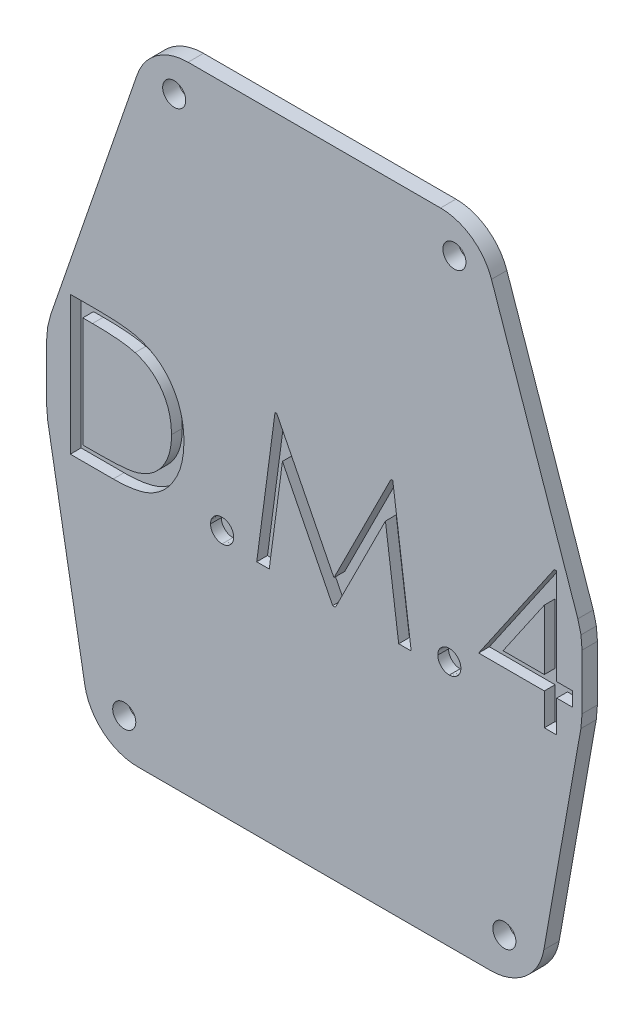
from build123d import *

# Parameters (mm, degrees)
SKETCH1_R           = 1.5
BOSS_EXTRUDE1_DEPTH = 2
CUT_EXTRUDE1_DEPTH  = 1.4


with BuildPart() as part:
    # Sketch1 → Boss-Extrude1 (new body)
    with BuildSketch(Plane.XY):
        with BuildLine():
            Line((-18.379825178, 53.839866214), (-29.600588692, 21.252402761))
            Line((-29.600588692, 21.252402761), (-30.008258951, 19.647197275))
            Line((-30.008258951, 19.647197275), (-30.145402936, 17.996721216))
            Line((-30.145402936, 17.996721216), (-30.145402936, 10.828474845))
            Line((-30.145402936, 10.828474845), (-29.993480466, 9.091993069))
            Line((-29.993480466, 9.091993069), (-25.178426095, -18.215537244))
            ThreePointArc((-25.178426095, -18.215537244), (-22.784285092, -22.362311102), (-18.284771824, -24))
            Line((-18.284771824, -24), (27.569413737, -24))
            ThreePointArc((27.569413737, -24), (32.068927004, -22.362311102), (34.463068008, -18.215537244))
            Line((34.463068008, -18.215537244), (39.278122378, 9.091993069))
            Line((39.278122378, 9.091993069), (39.430044848, 10.828474845))
            Line((39.430044848, 10.828474845), (39.430044848, 17.996721216))
            Line((39.430044848, 17.996721216), (39.292900864, 19.647197275))
            Line((39.292900864, 19.647197275), (38.885230604, 21.252402761))
            Line((38.885230604, 21.252402761), (27.66446709, 53.839866214))
            ThreePointArc((27.66446709, 53.839866214), (25.110757751, 57.259697761), (21.045837061, 58.560889132))
            Line((21.045837061, 58.560889132), (-11.761195149, 58.560889132))
            ThreePointArc((-11.761195149, 58.560889132), (-15.826115839, 57.259697761), (-18.379825178, 53.839866214))
        make_face()
        with Locations((-20.053399697, -19.107768622)):
            Circle(SKETCH1_R, mode=Mode.SUBTRACT)
        with Locations((29.33804161, -19.107768622)):
            Circle(SKETCH1_R, mode=Mode.SUBTRACT)
        with Locations((22.845645013, 54.084126822)):
            Circle(SKETCH1_R, mode=Mode.SUBTRACT)
        with Locations((-13.561003101, 54.084126822)):
            Circle(SKETCH1_R, mode=Mode.SUBTRACT)
    extrude(amount=BOSS_EXTRUDE1_DEPTH)

    # Sketch2 → Cut-Extrude1 (cut)
    # profile 1 of 5: a face of its own
    with BuildSketch(Plane.XY.offset(2)):
        with BuildLine():
            Line((-27.058965291, 6.803763441), (-27.058965291, 24.795430108))
            Line((-27.058965291, 24.795430108), (-23.426032599, 24.795430108))
            add(Edge.make_bspline(
                [(-23.426032599, 24.795430108), (-23.110052729, 24.793155088), (-22.499581264, 24.78875976), (-21.617411563, 24.760891228), (-20.801187413, 24.711591666), (-20.053593264, 24.63978165), (-19.372576748, 24.551606889), (-18.76004476, 24.441084572), (-18.212830054, 24.310577287), (-17.876285953, 24.199309365), (-17.717138368, 24.146692127)],
                knots=[0, 0, 0, 0, 1.314313732, 2.53924729, 3.670748893, 4.714932338, 5.66265055, 6.526160246, 7.303039223, 8, 8, 8, 8], degree=3))
            add(Edge.make_bspline(
                [(-17.717138368, 24.146692127), (-17.508976125, 24.067370952), (-17.097372067, 23.910527344), (-16.511321168, 23.614660547), (-15.959617695, 23.27943415), (-15.439303091, 22.904406275), (-14.962262653, 22.478958112), (-14.509860155, 22.021162284), (-14.100602563, 21.514371268), (-13.725819203, 20.969095318), (-13.387906611, 20.391757888), (-13.09418413, 19.783459079), (-12.850248007, 19.147288098), (-12.647748064, 18.485014087), (-12.488154488, 17.795180802), (-12.379269272, 17.076985), (-12.307451732, 16.333265072), (-12.300234239, 15.828601578), (-12.296572129, 15.572538482)],
                knots=[0, 0, 0, 0, 0.984719456, 1.947108742, 2.898477687, 3.838006223, 4.779231079, 5.722358779, 6.681677486, 7.655904652, 8.64651281, 9.637519902, 10.640069247, 11.656948941, 12.698408672, 13.768548281, 14.867775369, 16, 16, 16, 16], degree=3))
            add(Edge.make_bspline(
                [(-12.296572129, 15.572538482), (-12.299805321, 15.350155115), (-12.306176664, 14.911925464), (-12.363386648, 14.266071432), (-12.446540636, 13.639377621), (-12.575279738, 13.03482832), (-12.731563135, 12.447126838), (-12.931857427, 11.882536801), (-13.161305132, 11.335878981), (-13.428866294, 10.814544861), (-13.722600223, 10.320630573), (-14.037823184, 9.855029228), (-14.374198958, 9.424384695), (-14.734935128, 9.027392853), (-15.115370033, 8.664652178), (-15.517994389, 8.333132508), (-15.943847119, 8.039320599), (-16.391020858, 7.771670869), (-16.87256077, 7.538188613), (-17.397587758, 7.340640062), (-17.968340885, 7.176933294), (-18.583419202, 7.040346237), (-19.24388546, 6.931998865), (-19.950387192, 6.859382481), (-20.701838912, 6.810275858), (-21.217836135, 6.805976397), (-21.483422757, 6.803763441)],
                knots=[0, 0, 0, 0, 1.105936401, 2.179363191, 3.223086493, 4.248585256, 5.251745608, 6.245858792, 7.225916811, 8.198733463, 9.158002045, 10.082870192, 10.993790845, 11.873723703, 12.748670949, 13.606408763, 14.465103618, 15.319838547, 16.196477973, 17.123216899, 18.106603292, 19.147568657, 20.255746949, 21.433717677, 22.679120308, 24, 24, 24, 24], degree=3))
            Line((-21.483422757, 6.803763441), (-27.058965291, 6.803763441))
        make_face()
        with BuildLine():
            Line((-25.444328539, 8.649062587), (-23.3791793, 8.649062587))
            add(Edge.make_bspline(
                [(-23.3791793, 8.649062587), (-23.082427985, 8.65033792), (-22.511666528, 8.652790854), (-21.690948395, 8.674315072), (-20.94105883, 8.709485888), (-20.261891357, 8.758706348), (-19.653829444, 8.823829063), (-19.115602311, 8.896437789), (-18.648974257, 8.986897066), (-18.366610794, 9.068892593), (-18.236128753, 9.106783273)],
                knots=[0, 0, 0, 0, 1.375205317, 2.645023457, 3.804390687, 4.853969522, 5.800190428, 6.637939096, 7.370582563, 8, 8, 8, 8], degree=3))
            add(Edge.make_bspline(
                [(-18.236128753, 9.106783273), (-18.071898958, 9.16462164), (-17.747361994, 9.278916907), (-17.28018994, 9.487402598), (-16.844498575, 9.734361714), (-16.432694898, 10.008874832), (-16.050620495, 10.320624161), (-15.693747478, 10.662830744), (-15.362794361, 11.037236171), (-15.061180478, 11.443375745), (-14.791262791, 11.878721623), (-14.557519019, 12.338993866), (-14.35266317, 12.819149349), (-14.191876309, 13.326561429), (-14.065854532, 13.856693899), (-13.976591767, 14.409584052), (-13.920998934, 14.985128637), (-13.914514491, 15.376586818), (-13.911208881, 15.576142581)],
                knots=[0, 0, 0, 0, 0.998632004, 1.973411704, 2.929992603, 3.868527914, 4.809262121, 5.754881198, 6.702106254, 7.672490631, 8.653608572, 9.636854334, 10.631411391, 11.644891563, 12.686317036, 13.754757253, 14.855430412, 16, 16, 16, 16], degree=3))
            add(Edge.make_bspline(
                [(-13.911208881, 15.576142581), (-13.913847422, 15.786560162), (-13.919030861, 16.199927362), (-13.984182851, 16.806455722), (-14.079392467, 17.389800304), (-14.217073367, 17.950000123), (-14.392522337, 18.488148105), (-14.611479079, 19.00126792), (-14.861648676, 19.494778663), (-15.159299401, 19.957289748), (-15.485285749, 20.394708849), (-15.847061562, 20.795434237), (-16.238879136, 21.160378747), (-16.656464945, 21.495225833), (-17.111587796, 21.786504109), (-17.593526411, 22.047057787), (-18.109350945, 22.268179952), (-18.468221446, 22.385788201), (-18.65060024, 22.445556978)],
                knots=[0, 0, 0, 0, 1.122418816, 2.205001699, 3.251619955, 4.274784885, 5.280384055, 6.268708349, 7.249350384, 8.229342522, 9.199999885, 10.157847722, 11.105861043, 12.055065948, 13.010012805, 13.98527497, 14.976112212, 16, 16, 16, 16], degree=3))
            add(Edge.make_bspline(
                [(-18.65060024, 22.445556978), (-18.80147911, 22.487279282), (-19.122288982, 22.575992348), (-19.645792322, 22.672763727), (-20.234968769, 22.758118759), (-20.892434137, 22.830383776), (-21.617438978, 22.882237411), (-22.410540884, 22.921157573), (-23.27208266, 22.947408096), (-23.869316209, 22.949200617), (-24.179289477, 22.950130963)],
                knots=[0, 0, 0, 0, 0.674548936, 1.434276114, 2.292660221, 3.240891867, 4.284742987, 5.42552168, 6.663806718, 8, 8, 8, 8], degree=3))
            Line((-24.179289477, 22.950130963), (-25.444328539, 22.950130963))
            Line((-25.444328539, 22.950130963), (-25.444328539, 8.649062587))
        make_face(mode=Mode.SUBTRACT)
    # profile 2 of 5: a face of its own
    with BuildSketch(Plane.XY.offset(2)):
        with BuildLine():
            add(Edge.make_bspline(
                [(-7.337330676, 9.571712159), (-7.237141704, 9.565758631), (-7.040732938, 9.554087435), (-6.756777514, 9.474015914), (-6.499781156, 9.331837229), (-6.270864212, 9.142344994), (-6.082175444, 8.912588002), (-5.934929834, 8.657641414), (-5.855555817, 8.371308704), (-5.843969637, 8.173761875), (-5.83802512, 8.072406604)],
                knots=[0, 0, 0, 0, 1.020151414, 1.999887582, 2.974338812, 3.990962822, 5.007586832, 5.987933904, 6.967670073, 8, 8, 8, 8], degree=3))
            add(Edge.make_bspline(
                [(-5.83802512, 8.072406604), (-5.844171077, 7.973486725), (-5.856290815, 7.778418178), (-5.934747888, 7.494245135), (-6.083297628, 7.239139215), (-6.269562746, 7.006264652), (-6.499837746, 6.816370986), (-6.757385095, 6.675401936), (-7.040066348, 6.58959721), (-7.237030496, 6.578667031), (-7.337330676, 6.573101048)],
                knots=[0, 0, 0, 0, 1.009421747, 1.99056486, 2.972319754, 3.999869655, 5.017953583, 5.993804169, 6.978383603, 8, 8, 8, 8], degree=3))
            add(Edge.make_bspline(
                [(-7.337330676, 6.573101048), (-7.437703129, 6.578465635), (-7.63365645, 6.588938713), (-7.915282549, 6.67716371), (-8.174398371, 6.815049068), (-8.404628536, 7.006618729), (-8.59245368, 7.237940895), (-8.734461302, 7.496002034), (-8.819742568, 7.777604709), (-8.830958433, 7.973326504), (-8.836636231, 8.072406604)],
                knots=[0, 0, 0, 0, 1.022052826, 1.995314843, 2.982371812, 4.00089066, 5.028879526, 6.005146991, 6.990147033, 8, 8, 8, 8], degree=3))
            add(Edge.make_bspline(
                [(-8.836636231, 8.072406604), (-8.831176535, 8.17392782), (-8.820517149, 8.372135534), (-8.734282267, 8.655885232), (-8.593555502, 8.9137749), (-8.40333015, 9.141994463), (-8.174454067, 9.333154907), (-7.915907622, 9.472280831), (-7.632978175, 9.554736188), (-7.437588992, 9.565955364), (-7.337330676, 9.571712159)],
                knots=[0, 0, 0, 0, 1.032775665, 2.016367738, 2.991239715, 4.008302682, 5.025365648, 6.011011707, 6.979408107, 8, 8, 8, 8], degree=3))
        make_face()
    # profile 3 of 5: a face of its own
    with BuildSketch(Plane.XY.offset(2)):
        Polygon((-2.839414009, 6.803763441), (-0.46431218, 24.795430108), (-0.233649786, 24.795430108), (7.194400093, 10.033036946), (14.604429474, 24.795430108), (14.838695967, 24.795430108), (17.228214196, 6.803763441), (15.606369244, 6.803763441), (13.883609495, 19.749690258), (7.389021488, 6.803763441), (7.025007398, 6.803763441), (0.505190692, 19.778523057), (-1.213964957, 6.803763441), align=None)
    # profile 4 of 5: a face of its own
    with BuildSketch(Plane.XY.offset(2)):
        with BuildLine():
            add(Edge.make_bspline(
                [(22.187455649, 9.571712159), (22.287644621, 9.565758631), (22.484053386, 9.554087435), (22.76800881, 9.474015914), (23.025005168, 9.331837229), (23.253922112, 9.142344994), (23.442610881, 8.912588002), (23.589856491, 8.657641414), (23.669230508, 8.371308704), (23.680816688, 8.173761875), (23.686761205, 8.072406604)],
                knots=[0, 0, 0, 0, 1.020151414, 1.999887582, 2.974338812, 3.990962822, 5.007586832, 5.987933904, 6.967670073, 8, 8, 8, 8], degree=3))
            add(Edge.make_bspline(
                [(23.686761205, 8.072406604), (23.680615247, 7.973486725), (23.66849551, 7.778418178), (23.590038436, 7.494245135), (23.441488697, 7.239139215), (23.255223579, 7.006264652), (23.024948579, 6.816370986), (22.76740123, 6.675401936), (22.484719977, 6.58959721), (22.287755829, 6.578667031), (22.187455649, 6.573101048)],
                knots=[0, 0, 0, 0, 1.009421747, 1.99056486, 2.972319754, 3.999869655, 5.017953583, 5.993804169, 6.978383603, 8, 8, 8, 8], degree=3))
            add(Edge.make_bspline(
                [(22.187455649, 6.573101048), (22.087083196, 6.578465635), (21.891129875, 6.588938713), (21.609503776, 6.67716371), (21.350387954, 6.815049068), (21.120157788, 7.006618729), (20.932332645, 7.237940895), (20.790325022, 7.496002034), (20.705043757, 7.777604709), (20.693827892, 7.973326504), (20.688150093, 8.072406604)],
                knots=[0, 0, 0, 0, 1.022052826, 1.995314843, 2.982371812, 4.00089066, 5.028879526, 6.005146991, 6.990147033, 8, 8, 8, 8], degree=3))
            add(Edge.make_bspline(
                [(20.688150093, 8.072406604), (20.693609789, 8.17392782), (20.704269176, 8.372135534), (20.790504058, 8.655885232), (20.931230823, 8.9137749), (21.121456175, 9.141994463), (21.350332258, 9.333154907), (21.608878703, 9.472280831), (21.89180815, 9.554736188), (22.087197333, 9.565955364), (22.187455649, 9.571712159)],
                knots=[0, 0, 0, 0, 1.032775665, 2.016367738, 2.991239715, 4.008302682, 5.025365648, 6.011011707, 6.979408107, 8, 8, 8, 8], degree=3))
        make_face()
    # profile 5 of 5: a face of its own
    with BuildSketch(Plane.XY.offset(2)):
        Polygon((35.814557345, 25.256754894), (36.142530435, 25.256754894), (36.142530435, 12.800985664), (38.218491974, 12.800985664), (38.218491974, 10.955686518), (36.142530435, 10.955686518), (36.142530435, 6.803763441), (34.527893683, 6.803763441), (34.527893683, 10.955686518), (25.993385136, 10.955686518), align=None)
        Polygon((34.527893683, 12.800985664), (34.527893683, 20.614674232), (29.164993042, 12.800985664), align=None, mode=Mode.SUBTRACT)
    extrude(amount=-CUT_EXTRUDE1_DEPTH, mode=Mode.SUBTRACT)


solid = part.part
